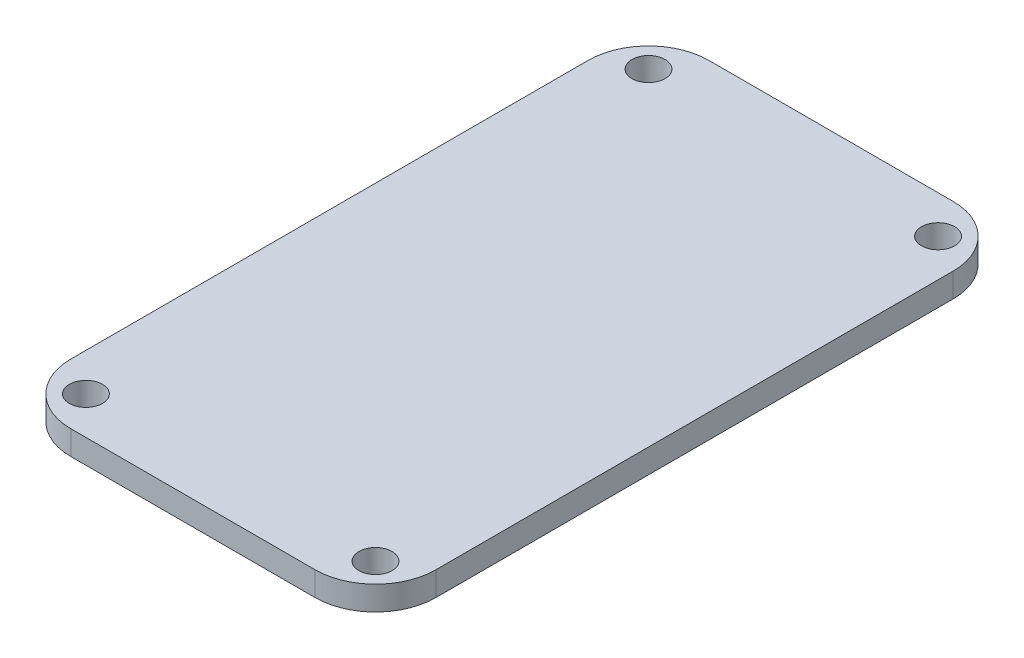
from build123d import *

# Parameters (mm, degrees)
SKETCH_1_W               = 24.2
SKETCH_1_H               = 42.3
EXTRUDE_1_DEPTH          = 1.6
FILLET_1_R               = 4
CUT_EXTRUDE_1_DEPTH      = 25.41910113
CUT_EXTRUDE_1_DEPTH_BACK = 25.41910113
SKETCH_2_R               = 1.1


with BuildPart() as part:
    # 草图1 → 凸台-拉伸1 (new body)
    with BuildSketch(Plane(origin=(0, 0, 0), x_dir=(1, 0, 0), z_dir=(0, 1, 0))):
        Rectangle(SKETCH_1_W, SKETCH_1_H)
    extrude(amount=EXTRUDE_1_DEPTH)

    # 圆角1
    fillet_1_edges = [part.edges().sort_by_distance(p)[0] for p in [
        (12.1, 0.8, 21.15),
        (-12.1, 0.8, 21.15),
        (-12.1, 0.8, -21.15),
        (12.1, 0.8, -21.15),
    ]]
    fillet(fillet_1_edges, radius=FILLET_1_R)

    # 草图2 → 切除-拉伸1 (cut, two sides: drawn at the far end of the back side and taken through both)
    with BuildSketch(Plane(origin=(0, 1.6, 0), x_dir=(1, 0, 0), z_dir=(0, 1, 0)).offset(-CUT_EXTRUDE_1_DEPTH_BACK)):
        with Locations(Location((-9.6, 18.65, 0), (0, 0, 270))):
            Circle(SKETCH_2_R)
        with Locations(Location((9.6, 18.65, 0), (0, 0, 270))):
            Circle(SKETCH_2_R)
        with Locations(Location((9.6, -18.65, 0), (0, 0, 270))):
            Circle(SKETCH_2_R)
        with Locations(Location((-9.6, -18.65, 0), (0, 0, 270))):
            Circle(SKETCH_2_R)
    extrude(amount=CUT_EXTRUDE_1_DEPTH + CUT_EXTRUDE_1_DEPTH_BACK, mode=Mode.SUBTRACT)


solid = part.part
